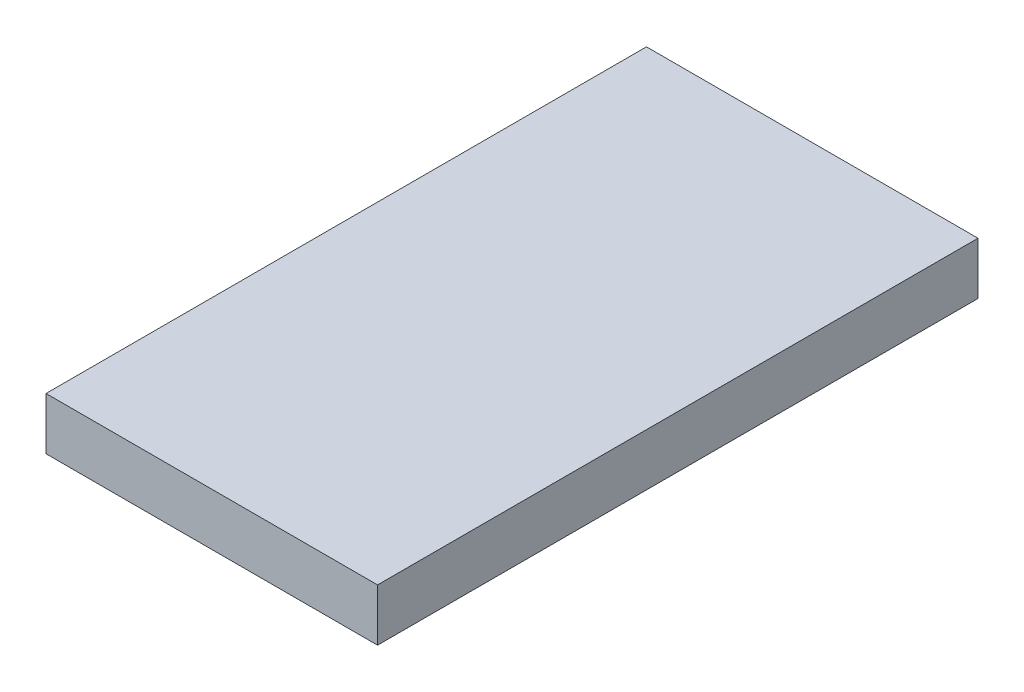
from build123d import *

# Parameters (mm, degrees)
SKETCH_1_W      = 12.7
SKETCH_1_H      = 23
EXTRUDE_1_DEPTH = 2


with BuildPart() as part:
    # 草图1 → 凸台-拉伸1 (new body)
    with BuildSketch(Plane(origin=(0, 0, 0), x_dir=(1, 0, 0), z_dir=(0, 1, 0))):
        with Locations((6.35, -11.5)):
            Rectangle(SKETCH_1_W, SKETCH_1_H)
    extrude(amount=EXTRUDE_1_DEPTH)


solid = part.part
